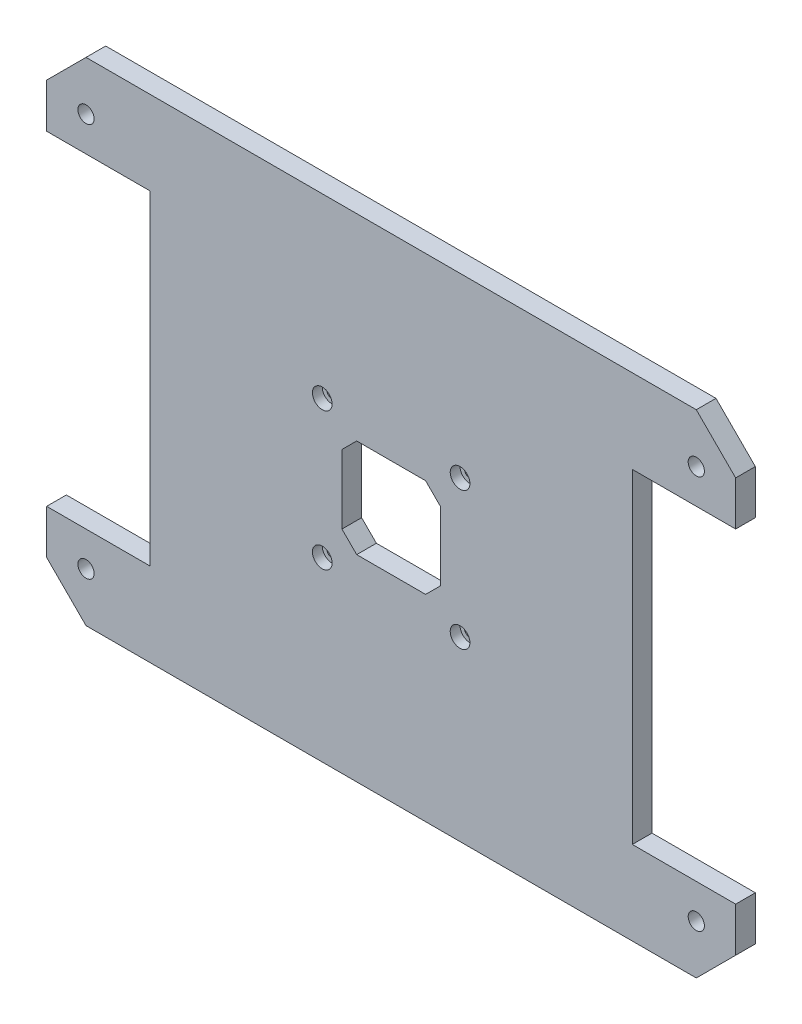
from build123d import *

# Parameters (mm, degrees)
EXTRUDE_START         = -4
SKETCH_1_R            = 1.65
SKETCH_1_R_2          = 1.1
EXTRUDE_266_DEPTH     = 4
CUT_EXTRUDE_START     = -4
SKETCH_2_W            = 32
SKETCH_2_H            = 66
CUT_EXTRUDE_347_DEPTH = 4
CUT_EXTRUDE_START_2   = -2
SKETCH_3_R            = 2
CUT_EXTRUDE_M2_DEPTH  = 2


with BuildPart() as part:
    # 草图1 → Extrude 266 (new body)
    with BuildSketch(Plane.XY.offset(EXTRUDE_START)):
        Polygon((-62, -50), (62, -50), (70, -42), (70, 42), (62, 50), (-62, 50), (-70, 42), (-70, -42), align=None)
        with Locations((-62, -40)):
            Circle(SKETCH_1_R, mode=Mode.SUBTRACT)
        with Locations((-14, -14)):
            Circle(SKETCH_1_R_2, mode=Mode.SUBTRACT)
        with Locations((-62, 40)):
            Circle(SKETCH_1_R, mode=Mode.SUBTRACT)
        with Locations((-14, 14)):
            Circle(SKETCH_1_R_2, mode=Mode.SUBTRACT)
        with Locations((62, -40)):
            Circle(SKETCH_1_R, mode=Mode.SUBTRACT)
        with Locations((14, -14)):
            Circle(SKETCH_1_R_2, mode=Mode.SUBTRACT)
        with Locations((62, 40)):
            Circle(SKETCH_1_R, mode=Mode.SUBTRACT)
        with Locations((14, 14)):
            Circle(SKETCH_1_R_2, mode=Mode.SUBTRACT)
        Polygon((-7, -10), (7, -10), (10, -7), (10, 7), (7, 10), (-7, 10), (-10, 7), (-10, -7), align=None, mode=Mode.SUBTRACT)
    extrude(amount=EXTRUDE_266_DEPTH)

    # 草图2 → Cut-Extrude 347 (cut)
    with BuildSketch(Plane.XY.offset(CUT_EXTRUDE_START)):
        with Locations((65, 0)):
            Rectangle(SKETCH_2_W, SKETCH_2_H)
        with Locations((-65, 0)):
            Rectangle(SKETCH_2_W, SKETCH_2_H)
    extrude(amount=CUT_EXTRUDE_347_DEPTH, mode=Mode.SUBTRACT)

    # 草图3 → M2头部内藏沉台 (cut)
    with BuildSketch(Plane.XY.offset(CUT_EXTRUDE_START_2)):
        with Locations((-14, -14)):
            Circle(SKETCH_3_R)
        with Locations((-14, 14)):
            Circle(SKETCH_3_R)
        with Locations((14, -14)):
            Circle(SKETCH_3_R)
        with Locations((14, 14)):
            Circle(SKETCH_3_R)
    extrude(amount=CUT_EXTRUDE_M2_DEPTH, mode=Mode.SUBTRACT)


solid = part.part
